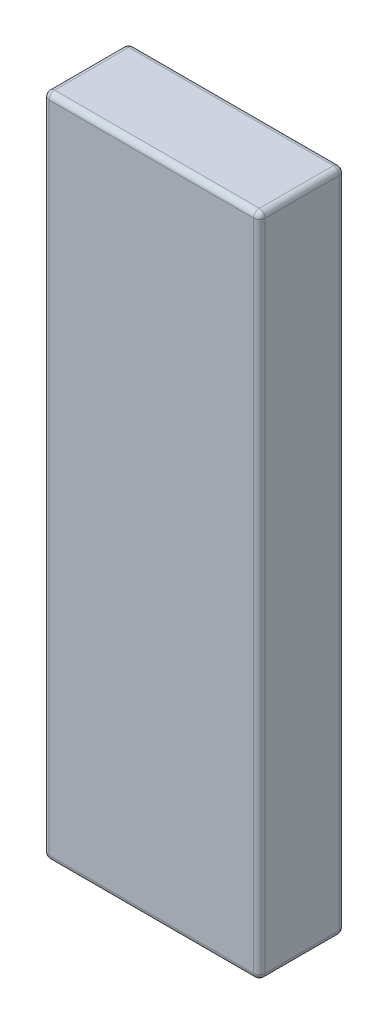
from build123d import *

# Parameters (mm, degrees)
SKETCH1_W           = 3.8
SKETCH1_H           = 11.7
BOSS_EXTRUDE1_DEPTH = 1.5
FILLET1_R           = 0.1


with BuildPart() as part:
    # Sketch1 → Boss-Extrude1 (new body)
    with BuildSketch(Plane.XY):
        Rectangle(SKETCH1_W, SKETCH1_H)
    extrude(amount=BOSS_EXTRUDE1_DEPTH)

    # Fillet1
    fillet1_edges = [part.edges().sort_by_distance(p)[0] for p in [
        (-1.9, 0, 1.5),
        (0, -5.85, 1.5),
        (1.9, 0, 1.5),
        (0, -5.85, 0),
        (-1.9, 0, 0),
        (0, 5.85, 0),
        (1.9, 0, 0),
        (1.9, -5.85, 0.75),
        (-1.9, -5.85, 0.75),
        (-1.9, 5.85, 0.75),
        (1.9, 5.85, 0.75),
        (0, 5.85, 1.5),
    ]]
    fillet(fillet1_edges, radius=FILLET1_R)


solid = part.part
